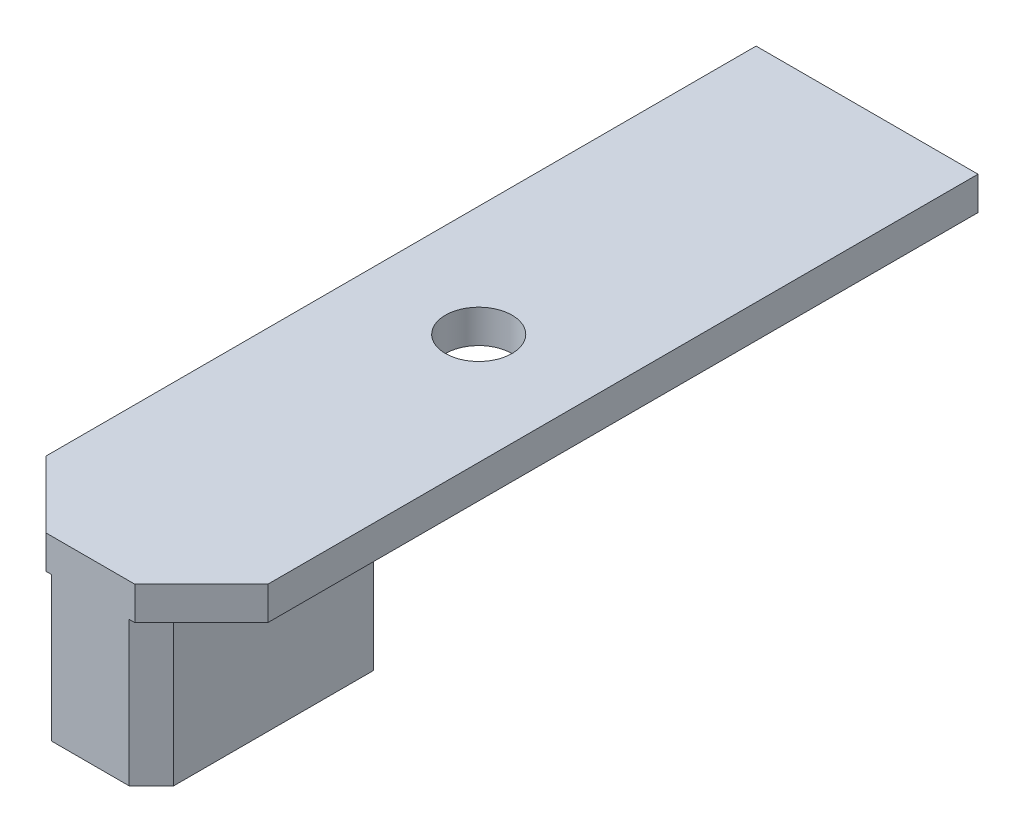
from build123d import *

# Parameters (mm, degrees)
BOSS_EXTRUDE1_DEPTH = 1.5
BOSS_EXTRUDE2_DEPTH = 6.5
SKETCH3_R           = 1.5
CUT_EXTRUDE1_DEPTH  = 6.5


with BuildPart() as part:
    # Sketch1 → Boss-Extrude1 (new body)
    with BuildSketch(Plane(origin=(0, 0, 0), x_dir=(1, 0, 0), z_dir=(0, 1, 0))):
        Polygon((-7, 0), (-10, 3), (-10, 35), (0, 35), (0, 3), (-3, 0), align=None)
    extrude(amount=BOSS_EXTRUDE1_DEPTH)

    # Sketch2 → Boss-Extrude2 (add)
    with BuildSketch(Plane.XZ):
        Polygon((-3.25, 0), (-6.75, 0), (-7.75, -1), (-7.75, -10), (-2.25, -10), (-2.25, -1), align=None)
    extrude(amount=BOSS_EXTRUDE2_DEPTH)

    # Sketch3 → Cut-Extrude1 (cut)
    with BuildSketch(Plane(origin=(0, 1.5, 0), x_dir=(1, 0, 0), z_dir=(0, 1, 0))):
        with Locations(Location((-5, 17.5, 0), (0, 0, 270))):
            Circle(SKETCH3_R)
    extrude(amount=-CUT_EXTRUDE1_DEPTH, mode=Mode.SUBTRACT)


solid = part.part
